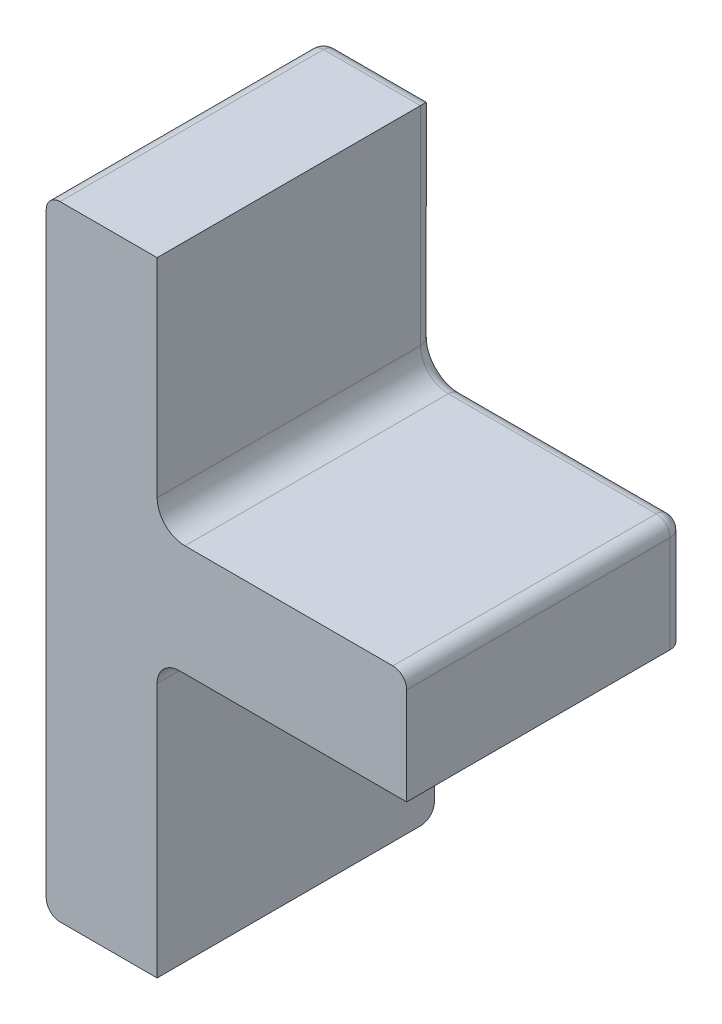
from build123d import *

# Parameters (mm, degrees)
BOSS_EXTRUDE1_DEPTH = 25.4
FILLET1_R           = 1.27


with BuildPart() as part:
    # Sketch1 → Boss-Extrude1 (new body)
    with BuildSketch(Plane.XY):
        with BuildLine():
            Line((0, 0), (0, 35.56))
            Line((0, 35.56), (0, 57.15))
            Line((0, 57.15), (10.16, 57.15))
            Line((10.16, 57.15), (10.16, 38.1))
            ThreePointArc((10.16, 38.1), (10.903948776, 36.303948776), (12.7, 35.56))
            Line((12.7, 35.56), (33.02, 35.56))
            Line((33.02, 35.56), (33.02, 25.4))
            Line((33.02, 25.4), (12.192, 25.4))
            ThreePointArc((12.192, 25.4), (10.755159021, 24.804840979), (10.16, 23.368))
            Line((10.16, 23.368), (10.16, 0))
            Line((10.16, 0), (0, 0))
        make_face()
    extrude(amount=BOSS_EXTRUDE1_DEPTH)

    # Fillet1
    fillet1_edges = [part.edges().sort_by_distance(p)[0] for p in [
        (0, 0, 12.7),
        (0, 57.15, 12.7),
        (0, 28.575, 0),
        (5.08, 0, 0),
        (10.16, 47.625, 0),
        (10.903948776, 36.303948776, 0),
        (22.86, 35.56, 0),
        (5.08, 57.15, 0),
        (33.02, 35.56, 12.7),
        (33.02, 30.48, 0),
    ]]
    fillet(fillet1_edges, radius=FILLET1_R)


solid = part.part
